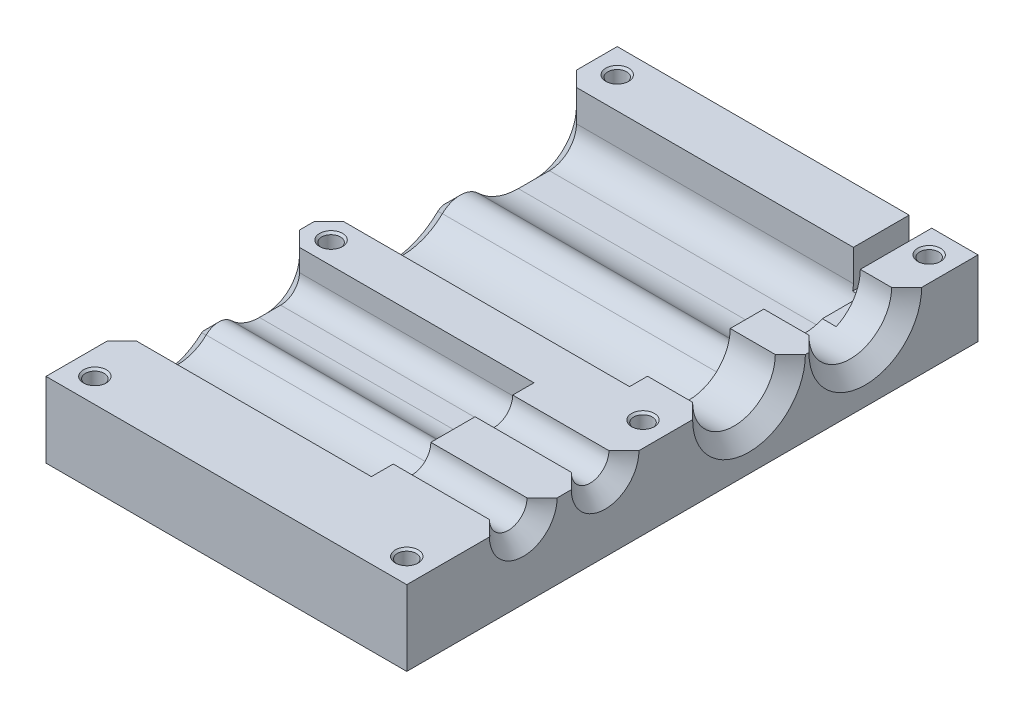
from build123d import *

# Parameters (mm, degrees)
SKETCH1_W                   = 48
SKETCH1_H                   = 76
BOSS_EXTRUDE1_DEPTH         = 10
SKETCH2_R                   = 5.5
SKETCH2_R_2                 = 2.5
CUT_EXTRUDE1_DEPTH          = 63.032249677
CUT_EXTRUDE2_DEPTH          = 40
FILLET1_R                   = 3.6
FILLET2_R                   = 2.5
M3_TAPPED_HOLE1_D           = 2.5
M3_TAPPED_HOLE1_CSINK_D     = 3.05
M3_TAPPED_HOLE1_CSINK_ANGLE = 90
CHAMFER1_SIZE               = 2
BOSS_EXTRUDE2_START         = 6.8
BOSS_EXTRUDE2_DEPTH         = 6.8
CHAMFER2_SIZE               = 2
SKETCH7_W                   = 3
SKETCH7_H                   = 18.523335373
CUT_EXTRUDE3_DEPTH          = 5


with BuildPart() as part:
    # Sketch1 → Boss-Extrude1 (new body)
    with BuildSketch(Plane(origin=(0, 0, 0), x_dir=(1, 0, 0), z_dir=(0, 1, 0))):
        Rectangle(SKETCH1_W, SKETCH1_H)
    extrude(amount=BOSS_EXTRUDE1_DEPTH)

    # Sketch2 → Cut-Extrude1 (cut, through all)
    with BuildSketch(Plane.ZY.offset(24)):
        with Locations((-23, 10)):
            Circle(SKETCH2_R)
        with Locations((-7.531152857, 10)):
            Circle(SKETCH2_R)
        with Locations((11.608764346, 10)):
            Circle(SKETCH2_R_2)
        with Locations((22.5, 10)):
            Circle(SKETCH2_R_2)
    extrude(amount=-CUT_EXTRUDE1_DEPTH, mode=Mode.SUBTRACT)

    # Sketch3 → Cut-Extrude2 (cut)
    with BuildSketch(Plane.ZY.offset(24)):
        with BuildLine():
            Line((-30.575601228, 16.807330276), (-30.575601228, 2.210930276))
            Line((-30.575601228, 2.210930276), (-22.840601228, 2.210930276))
            ThreePointArc((-22.840601228, 2.210930276), (-19.946134653, 2.772905234), (-17.472254435, 4.377171194))
            ThreePointArc((-17.472254435, 4.377171194), (-15.105601228, 5.332165574), (-12.73894802, 4.377171194))
            ThreePointArc((-12.73894802, 4.377171194), (0.284776113, 8.838942121), (-10.941513582, 16.807330276))
            Line((-10.941513582, 16.807330276), (-30.575601228, 16.807330276))
        make_face()
        with BuildLine():
            Line((6.278500547, 18.195630094), (6.278500547, 4.592448506))
            Line((6.278500547, 4.592448506), (11.608764346, 4.592448506))
            ThreePointArc((11.608764346, 4.592448506), (13.631545875, 4.985025618), (15.360627849, 6.105756374))
            ThreePointArc((15.360627849, 6.105756374), (17.025161235, 6.778090853), (18.691008119, 6.109017464))
            ThreePointArc((18.691008119, 6.109017464), (27.812192286, 11.050917016), (17.515830977, 12.317137997))
            Line((17.515830977, 12.317137997), (6.278500547, 18.195630094))
        make_face()
    extrude(amount=-CUT_EXTRUDE2_DEPTH, mode=Mode.SUBTRACT)

    # Fillet1
    fillet1_edges = [part.edges().sort_by_distance(p)[0] for p in [
        (-4, 2.210930276, -30.575601228),
    ]]
    fillet(fillet1_edges, radius=FILLET1_R)

    # Fillet2
    fillet2_edges = [part.edges().sort_by_distance(p)[0] for p in [
        (-4, 4.592448506, 6.278500547),
    ]]
    fillet(fillet2_edges, radius=FILLET2_R)

    # M3 Tapped Hole1 (through all)
    with Locations(Plane(origin=(0, 10, 0), x_dir=(1, 0, 0), z_dir=(0, 1, 0))):
        with Locations((-20.75, 34.75), (20.75, 34.75), (20.75, -3.321355168), (-20.75, -3.321355168), (-20.75, -34.75), (20.75, -34.75)):
            CounterSinkHole(M3_TAPPED_HOLE1_D / 2, M3_TAPPED_HOLE1_CSINK_D / 2, counter_sink_angle=M3_TAPPED_HOLE1_CSINK_ANGLE)

    # Chamfer1
    chamfer1_edges = [part.edges().sort_by_distance(p)[0] for p in [
        (-24, 2.210930276, -24.908101228),
        (-24, 3.265345864, -29.52118564),
        (-24, 4.592448506, 10.193632446),
        (-24, 5.324681553, 7.010733594),
        (-24, 7.905465138, -30.575601228),
        (-24, 2.772905234, -19.946134653),
        (-24, 5.332165574, -15.105601228),
        (-24, 2.837756402, -4.320340718),
        (-24, 8.546224253, 6.278500547),
        (-24, 4.985025618, 13.631545875),
        (-24, 6.778090853, 17.025161235),
        (-24, 5.021244944, 24.57967394),
    ]]
    chamfer(chamfer1_edges, length=CHAMFER1_SIZE)

    # Sketch6 → Boss-Extrude2 (add)
    with BuildSketch(Plane.ZY.offset(-16).offset(BOSS_EXTRUDE2_START)):
        with BuildLine():
            Line((6.278500547, 10), (6.278500547, 7.092448506))
            ThreePointArc((6.278500547, 7.092448506), (7.010733594, 5.324681553), (8.778500547, 4.592448506))
            Line((8.778500547, 4.592448506), (11.608764346, 4.592448506))
            ThreePointArc((11.608764346, 4.592448506), (13.631545875, 4.985025618), (15.360627849, 6.105756374))
            ThreePointArc((15.360627849, 6.105756374), (17.025161235, 6.778090853), (18.691008119, 6.109017464))
            ThreePointArc((18.691008119, 6.109017464), (24.57967394, 5.021244944), (27.907080182, 10))
            Line((27.907080182, 10), (25, 10))
            ThreePointArc((25, 10), (22.5, 7.5), (20, 10))
            Line((20, 10), (14.108764346, 10))
            ThreePointArc((14.108764346, 10), (11.608764346, 7.5), (9.108764346, 10))
            Line((9.108764346, 10), (6.278500547, 10))
        make_face()
    extrude(amount=-BOSS_EXTRUDE2_DEPTH)

    # Chamfer2
    chamfer2_edges = [part.edges().sort_by_distance(p)[0] for p in [
        (24, 4.5, -23),
        (24, 4.5, -7.531152857),
        (24, 7.5, 11.608764346),
        (24, 7.5, 22.5),
    ]]
    chamfer(chamfer2_edges, length=CHAMFER2_SIZE)

    # Sketch7 → Cut-Extrude3 (cut)
    with BuildSketch(Plane(origin=(0, 10, 0), x_dir=(1, 0, 0), z_dir=(0, 1, 0))):
        with Locations((16.34197527, 33.304071339)):
            Rectangle(SKETCH7_W, SKETCH7_H)
    extrude(amount=-CUT_EXTRUDE3_DEPTH, mode=Mode.SUBTRACT)


solid = part.part
